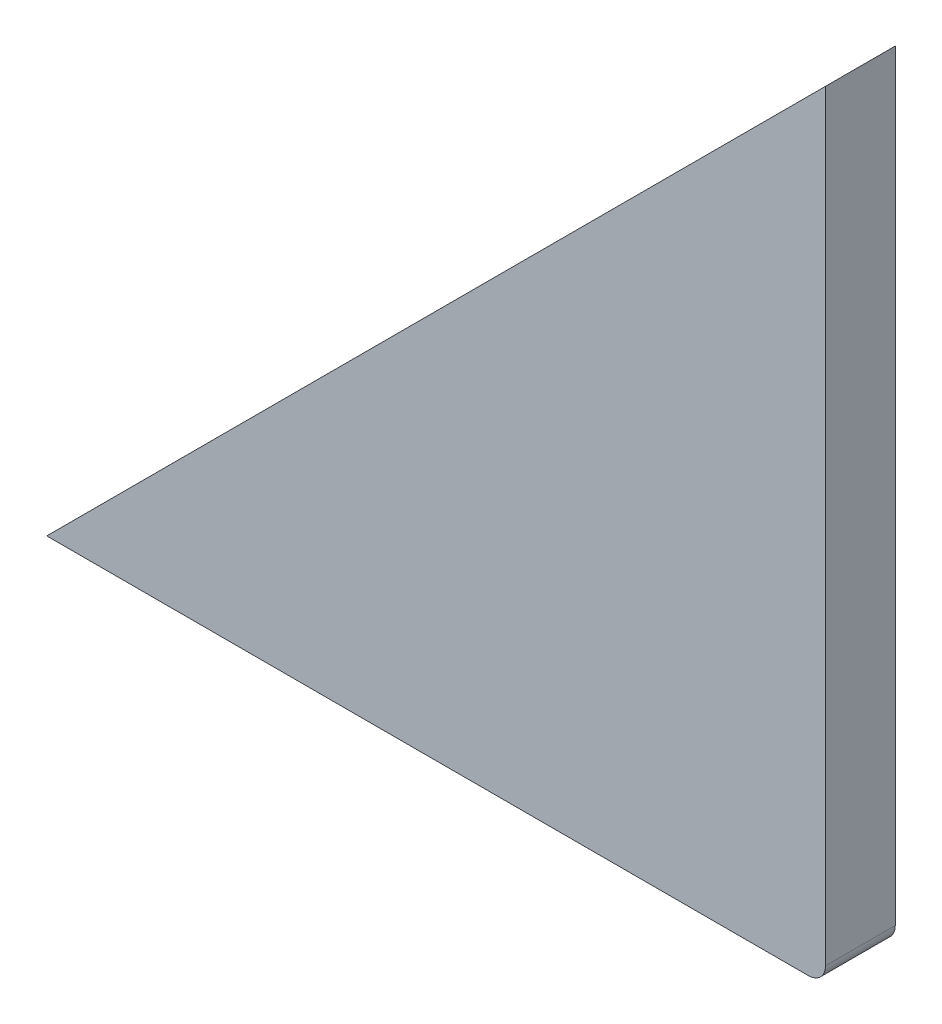
from build123d import *

# Parameters (mm, degrees)
BOSS_EXTRUDE1_DEPTH = 1.5


with BuildPart() as part:
    # Sketch1 → Boss-Extrude1 (new, symmetric)
    with BuildSketch(Plane.XY.offset(8.833409082)):
        with BuildLine():
            Line((-114, 13.600921456), (-81.2366, 13.600921456))
            ThreePointArc((-81.2366, 13.600921456), (-80.715745145, 13.816666601), (-80.5, 14.337521456))
            Line((-80.5, 14.337521456), (-80.5, 47.100921456))
            Line((-80.5, 47.100921456), (-114, 13.600921456))
        make_face()
    extrude(amount=BOSS_EXTRUDE1_DEPTH, both=True)


solid = part.part
